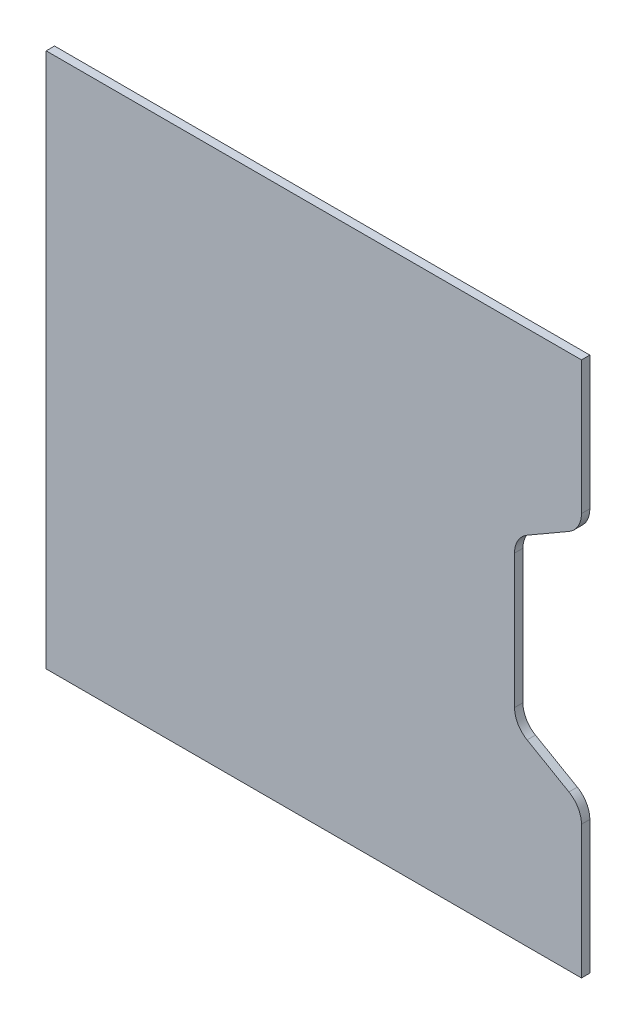
from build123d import *

# Parameters (mm, degrees)
SKETCH1_W           = 203.2
SKETCH1_H           = 203.2
BOSS_EXTRUDE1_DEPTH = 3.175
CUT_EXTRUDE4_DEPTH  = 144.719172782


with BuildPart() as part:
    # Sketch1 → Boss-Extrude1 (new body)
    with BuildSketch(Plane.XY):
        Rectangle(SKETCH1_W, SKETCH1_H)
    extrude(amount=-BOSS_EXTRUDE1_DEPTH)

    # Sketch10 → Cut-Extrude4 (cut, through all)
    with BuildSketch(Plane.XY):
        with BuildLine():
            Line((96.8375, 42.814327494), (80.9625, 33.648891971))
            ThreePointArc((80.9625, 33.648891971), (77.476108029, 30.1625), (76.2, 25.4))
            Line((76.2, 25.4), (76.2, -25.4))
            ThreePointArc((76.2, -25.4), (77.476108029, -30.1625), (80.9625, -33.648891971))
            Line((80.9625, -33.648891971), (96.8375, -42.814327494))
            ThreePointArc((96.8375, -42.814327494), (100.323891971, -46.300719465), (101.6, -51.063219465))
            Line((101.6, -51.063219465), (101.6, 51.063219465))
            ThreePointArc((101.6, 51.063219465), (100.323891971, 46.300719465), (96.8375, 42.814327494))
        make_face()
    extrude(amount=-CUT_EXTRUDE4_DEPTH, mode=Mode.SUBTRACT)


solid = part.part
